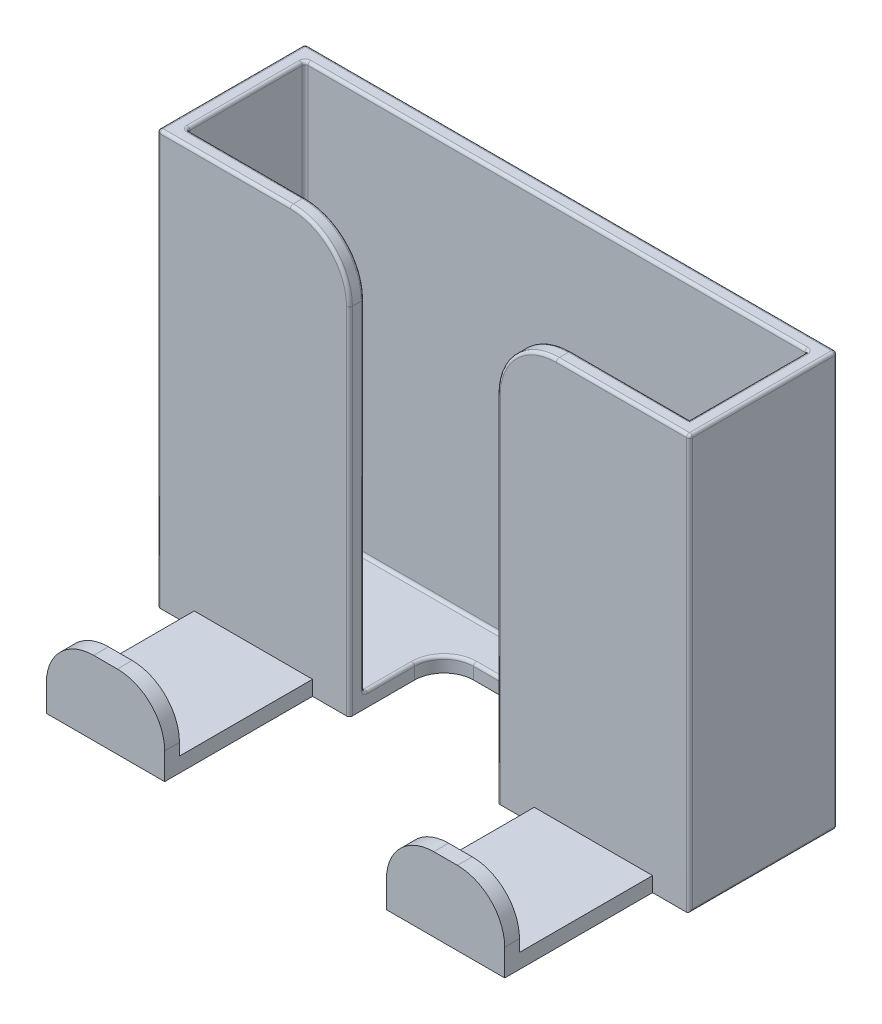
from build123d import *

# Parameters (mm, degrees)
SKETCH1_W            = 90
SKETCH1_H            = 70
BOSS_EXTRUDE1_DEPTH  = 25
SHELL1_T             = -2.5
SKETCH2_W            = 25
SKETCH2_H            = 70
CUT_EXTRUDE1_DEPTH   = 16
SKETCH3_W            = 20
SKETCH3_H            = 2.5
BOSS_EXTRUDE2_DEPTH  = 25
SKETCH4_W            = 20
SKETCH4_H            = 2.5
BOSS_EXTRUDE3_DEPTH  = 10
FILLET1_R            = 8
FILLET1_OF_MIRROR2_R = 8
FILLET3_R            = 10
FILLET4_R            = 5
FILLET5_R            = 0.5


with BuildPart() as part:
    # Sketch1 → Boss-Extrude1 (new body)
    with BuildSketch(Plane.XY):
        Rectangle(SKETCH1_W, SKETCH1_H)
    extrude(amount=BOSS_EXTRUDE1_DEPTH)

    # Shell1
    shell1_openings = [part.faces().sort_by_distance(p)[0] for p in [
        (0, 35, 12.5),
    ]]
    offset(amount=SHELL1_T, openings=shell1_openings, kind=Kind.INTERSECTION)

    # Sketch2 → Cut-Extrude1 (cut)
    with BuildSketch(Plane.XY.offset(25)):
        Rectangle(SKETCH2_W, SKETCH2_H)
    extrude(amount=-CUT_EXTRUDE1_DEPTH, mode=Mode.SUBTRACT)

    # Sketch3 → Boss-Extrude2 (add)
    with BuildSketch(Plane.XY.offset(25)):
        with Locations((-28.75, -33.75)):
            Rectangle(SKETCH3_W, SKETCH3_H)
    boss_extrude2 = extrude(amount=BOSS_EXTRUDE2_DEPTH)

    # Sketch4 → Boss-Extrude3 (add)
    with BuildSketch(Plane(origin=(0, -32.5, 0), x_dir=(1, 0, 0), z_dir=(0, 1, 0))):
        with Locations((-28.75, -48.75)):
            Rectangle(SKETCH4_W, SKETCH4_H)
    boss_extrude3 = extrude(amount=BOSS_EXTRUDE3_DEPTH)

    # Fillet1
    fillet1_edges = [part.edges().sort_by_distance(p)[0] for p in [
        (-18.75, -22.5, 48.75),
        (-38.75, -22.5, 48.75),
    ]]
    fillet(fillet1_edges, radius=FILLET1_R)

    # Mirror2: Boss-Extrude2, Boss-Extrude3 across plane
    add(boss_extrude2.mirror(Plane(origin=(0, 0, 0), x_dir=(0, 0, 1), z_dir=(1, 0, 0))))
    add(boss_extrude3.mirror(Plane(origin=(0, 0, 0), x_dir=(0, 0, 1), z_dir=(1, 0, 0))))

    # Fillet1 of Mirror2
    fillet1_of_mirror2_edges = [part.edges().sort_by_distance(p)[0] for p in [
        (18.75, -22.5, 48.75),
        (38.75, -22.5, 48.75),
    ]]
    fillet(fillet1_of_mirror2_edges, radius=FILLET1_OF_MIRROR2_R)

    # Fillet3
    fillet3_edges = [part.edges().sort_by_distance(p)[0] for p in [
        (-12.5, 35, 23.75),
        (12.5, 35, 23.75),
    ]]
    fillet(fillet3_edges, radius=FILLET3_R)

    # Fillet4
    fillet4_edges = [part.edges().sort_by_distance(p)[0] for p in [
        (12.5, -33.75, 9),
        (-12.5, -33.75, 9),
    ]]
    fillet(fillet4_edges, radius=FILLET4_R)

    # Fillet5
    fillet5_edges = [part.edges().sort_by_distance(p)[0] for p in [
        (42.5, 35, 12.5),
        (12.5, -3.75, 22.5),
        (15.428932188, 32.071067812, 22.5),
        (33.75, 35, 25),
        (15.428932188, 32.071067812, 25),
        (-32.5, 35, 22.5),
        (-33.75, 35, 25),
        (-15.428932188, 32.071067812, 25),
        (-45, 35, 12.5),
        (-45, 0, 25),
        (-45, -35, 12.5),
        (45, -35, 12.5),
        (45, 0, 25),
        (45, 35, 12.5),
        (0, 35, 0),
        (-45, 0, 0),
        (0, -35, 0),
        (45, 0, 0),
        (-42.5, 1.25, 22.5),
        (-42.5, 35, 12.5),
        (-27.5, -32.5, 22.5),
        (-42.5, -32.5, 12.5),
        (42.5, -32.5, 12.5),
        (27.5, -32.5, 22.5),
        (12.5, -32.5, 18.25),
        (11.035533906, -32.5, 10.464466094),
        (0, -32.5, 9),
        (-11.035533906, -32.5, 10.464466094),
        (-12.5, -32.5, 18.25),
        (0, -32.5, 2.5),
        (-42.5, 1.25, 2.5),
        (0, 35, 2.5),
        (42.5, 1.25, 2.5),
        (-15.428932188, 32.071067812, 22.5),
        (32.5, 35, 22.5),
        (12.5, -5, 25),
        (-12.5, -3.75, 22.5),
        (-12.5, -5, 25),
    ]]
    fillet(fillet5_edges, radius=FILLET5_R)


solid = part.part
